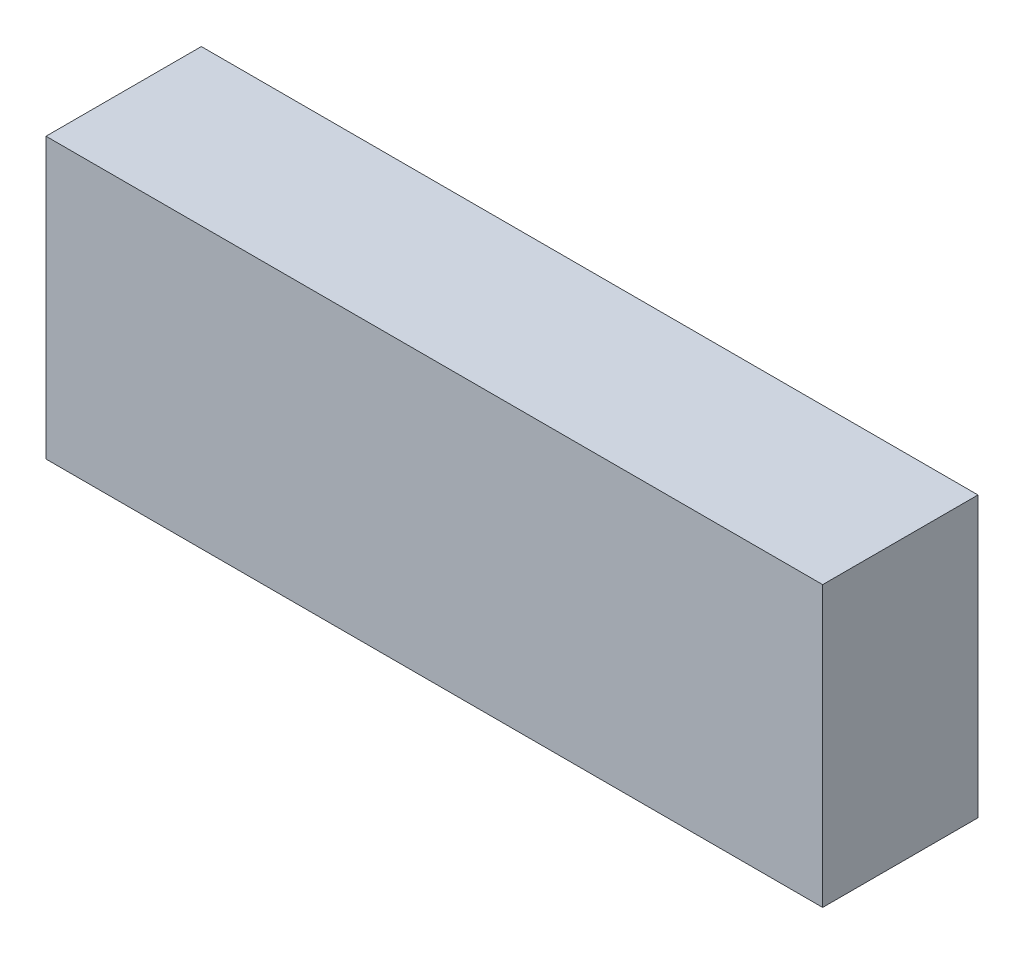
from build123d import *

# Parameters (mm, degrees)
SKETCH1_W           = 50
SKETCH1_H           = 18
BOSS_EXTRUDE1_DEPTH = 10


with BuildPart() as part:
    # Sketch1 → Boss-Extrude1 (new body)
    with BuildSketch(Plane.XY):
        with Locations((25, 9)):
            Rectangle(SKETCH1_W, SKETCH1_H)
    extrude(amount=BOSS_EXTRUDE1_DEPTH)


solid = part.part
